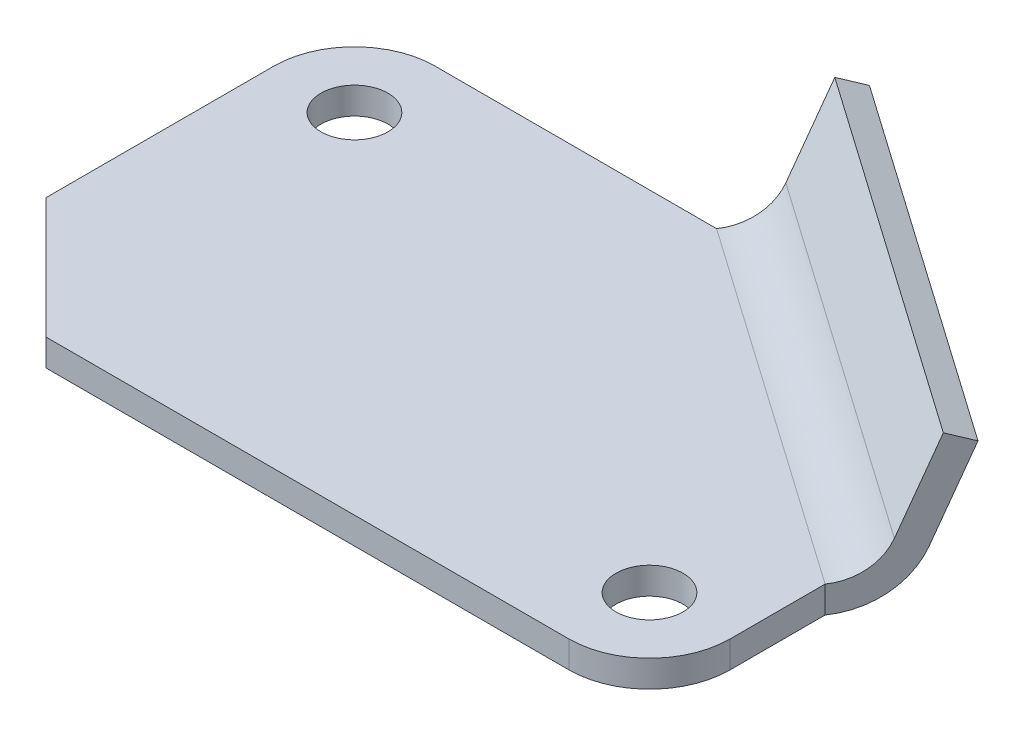
from build123d import *

# Parameters (mm, degrees)
SKETCH1_R           = 5
BOSS_EXTRUDE1_DEPTH = 4
BOSS_EXTRUDE4_DEPTH = 65.921828


with BuildPart() as part:
    # Sketch1 → Boss-Extrude1 (new body)
    with BuildSketch(Plane(origin=(0, 0, 0), x_dir=(1, 0, 0), z_dir=(0, 1, 0))):
        with BuildLine():
            Line((108, 26.188792937), (54, 64))
            Line((54, 64), (12, 64))
            ThreePointArc((12, 64), (3.514718626, 60.485281374), (0, 52))
            Line((0, 52), (0, 18))
            Line((0, 18), (18, 0))
            Line((18, 0), (96, 0))
            ThreePointArc((96, 0), (104.485281374, 3.514718626), (108, 12))
            Line((108, 12), (108, 26.188792937))
        make_face()
        with Locations(Location((96, 12, 0), (0, 0, 270))):
            Circle(SKETCH1_R, mode=Mode.SUBTRACT)
        with Locations(Location((12, 52, 0), (0, 0, 270))):
            Circle(SKETCH1_R, mode=Mode.SUBTRACT)
    extrude(amount=BOSS_EXTRUDE1_DEPTH)

    # Sketch4 → Boss-Extrude4 (add)
    with BuildSketch(Plane(origin=(60.164380005, 0, 42.127552411), x_dir=(0, -1, 0), z_dir=(0.819152044288991, 0, 0.5735764363510472))):
        with BuildLine():
            Line((-9.003147253, 90.816329234), (-21.983721217, 96.060821542))
            Line((-21.983721217, 96.060821542), (-20.485294843, 99.76955696))
            Line((-20.485294843, 99.76955696), (-7.504720879, 94.525064652))
            ThreePointArc((-7.504720879, 94.525064652), (-2.051549129, 90.109173239), (0, 83.398858397))
            Line((0, 83.398858397), (-4, 83.398858397))
            ThreePointArc((-4, 83.398858397), (-5.36769942, 87.872401625), (-9.003147253, 90.816329234))
        make_face()
    extrude(amount=-BOSS_EXTRUDE4_DEPTH)


solid = part.part
